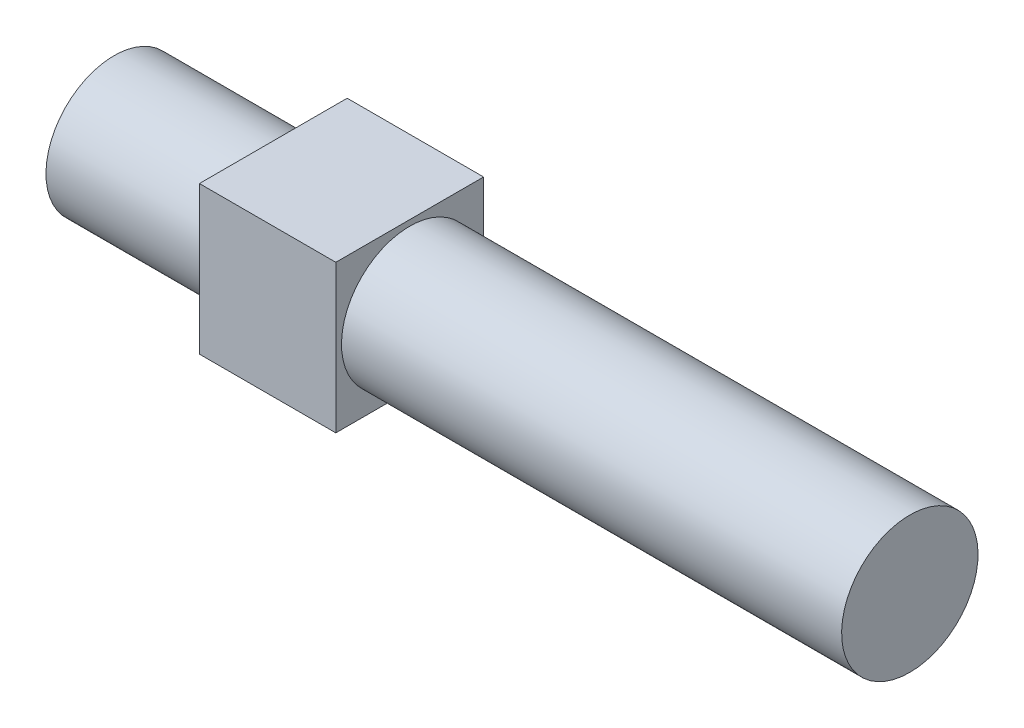
from build123d import *

# Parameters (mm, degrees)
SKETCH1_W           = 70
SKETCH1_H           = 6
SKETCH2_W           = 13
SKETCH2_H           = 13
BOSS_EXTRUDE1_DEPTH = 12


with BuildPart() as part:
    # Sketch1 → Revolve1 (revolve)
    with BuildSketch(Plane.XY, mode=Mode.PRIVATE) as revolve1_sk:
        with Locations((35, -3)):
            Rectangle(SKETCH1_W, SKETCH1_H)
    revolve(revolve1_sk.sketch.rotate(Axis((0, -6, 0), (1, 0, 0)), 180), axis=Axis((0, -6, 0), (1, 0, 0)))

    # Sketch2 → Boss-Extrude1 (add)
    with BuildSketch(Plane(origin=(14, 0, 0), x_dir=(0, 0, -1), z_dir=(1, 0, 0))):
        with Locations((0, -6)):
            Rectangle(SKETCH2_W, SKETCH2_H)
    extrude(amount=BOSS_EXTRUDE1_DEPTH)


solid = part.part
